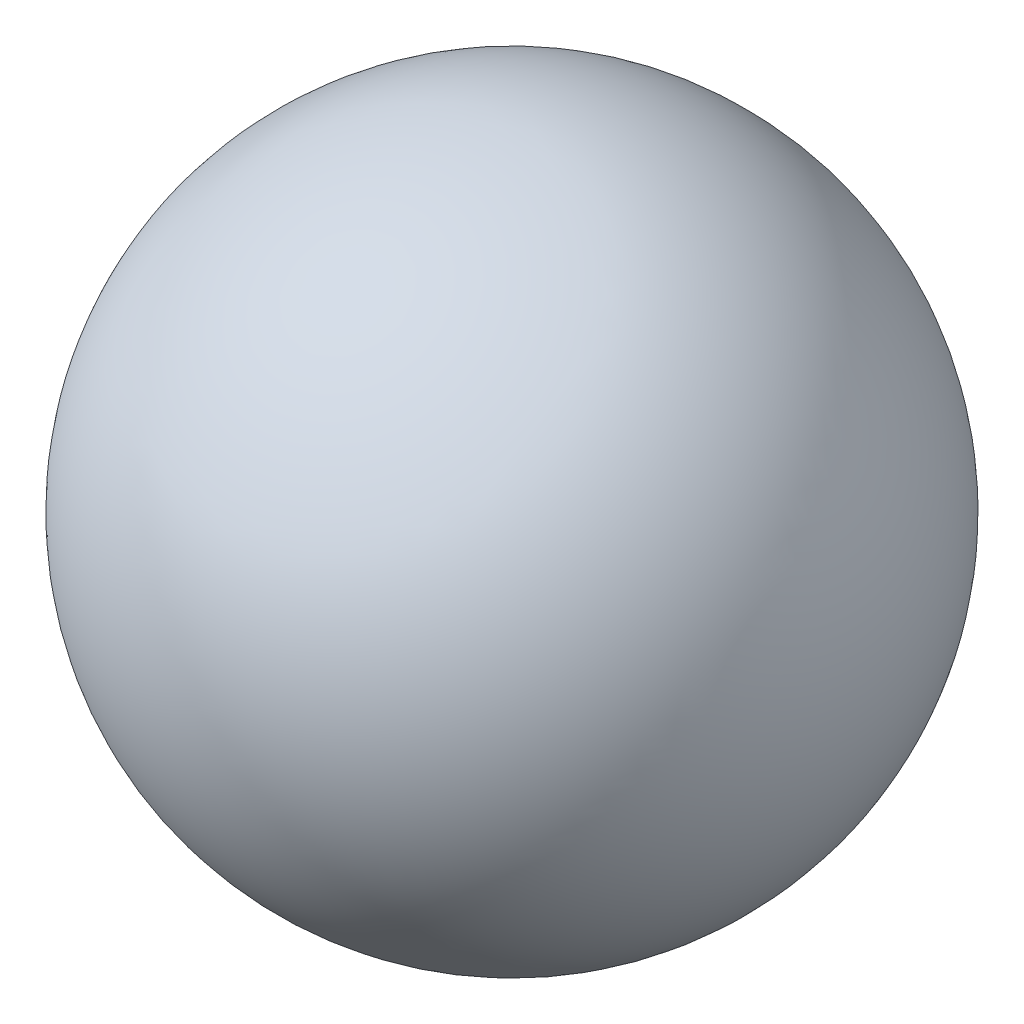
from build123d import *


with BuildPart() as part:
    # Sketch1 → Revolve1 (revolve)
    with BuildSketch(Plane.XY):
        with BuildLine():
            Line((2.1, 2.95), (0.9, 2.95))
            ThreePointArc((0.9, 2.95), (1.5, 3.55), (2.1, 2.95))
        make_face()
    revolve(axis=Axis((2.1, 2.95, 0), (-1, 0, 0)))


solid = part.part
